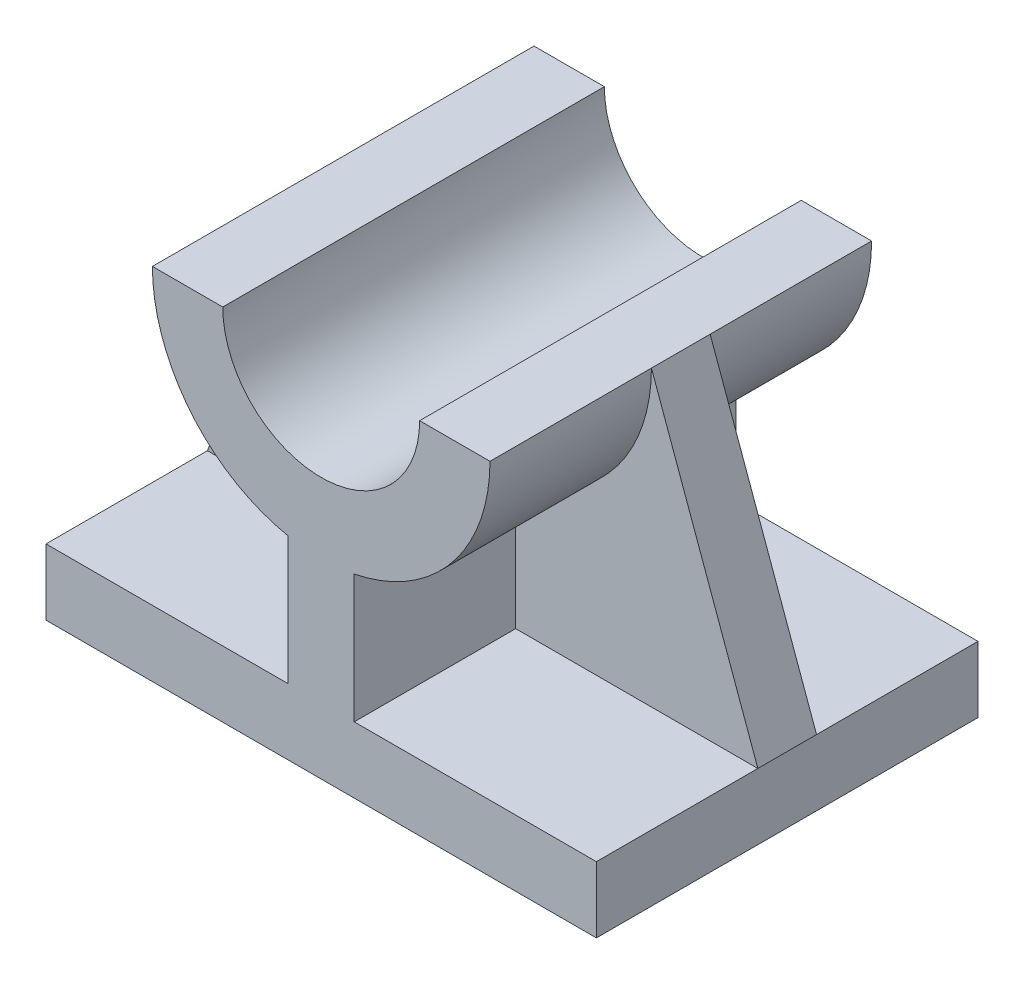
from build123d import *

# Parameters (mm, degrees)
BOSS_EXTRUDE1_DEPTH = 26
BOSS_EXTRUDE2_DEPTH = 4


with BuildPart() as part:
    # Sketch1 → Boss-Extrude1 (new, symmetric)
    with BuildSketch(Plane.XY):
        with BuildLine():
            Line((-37.5, 9), (-37.5, 0))
            Line((-37.5, 0), (37.5, 0))
            Line((37.5, 0), (37.5, 9))
            Line((37.5, 9), (4.5, 9))
            Line((4.5, 9), (4.5, 26.444512863))
            ThreePointArc((4.5, 26.444512863), (17.783419244, 34.414047854), (23, 49))
            Line((23, 49), (13.415512749, 49))
            ThreePointArc((13.415512749, 49), (0, 35.584487251), (-13.415512749, 49))
            Line((-13.415512749, 49), (-23, 49))
            ThreePointArc((-23, 49), (-17.783419244, 34.414047854), (-4.5, 26.444512863))
            Line((-4.5, 26.444512863), (-4.5, 9))
            Line((-4.5, 9), (-37.5, 9))
        make_face()
    extrude(amount=BOSS_EXTRUDE1_DEPTH, both=True)

    # Sketch1<3> → Boss-Extrude2 (add, symmetric)
    with BuildSketch(Plane.XY):
        with BuildLine():
            Line((-23, 49), (-37.5, 9))
            Line((-37.5, 9), (-4.5, 9))
            Line((-4.5, 9), (-4.5, 26.444512863))
            ThreePointArc((-4.5, 26.444512863), (-17.783419244, 34.414047854), (-23, 49))
        make_face()
        with BuildLine():
            Line((4.5, 9), (37.5, 9))
            Line((37.5, 9), (23, 49))
            ThreePointArc((23, 49), (17.783419244, 34.414047854), (4.5, 26.444512863))
            Line((4.5, 26.444512863), (4.5, 9))
        make_face()
    extrude(amount=BOSS_EXTRUDE2_DEPTH, both=True)


solid = part.part
